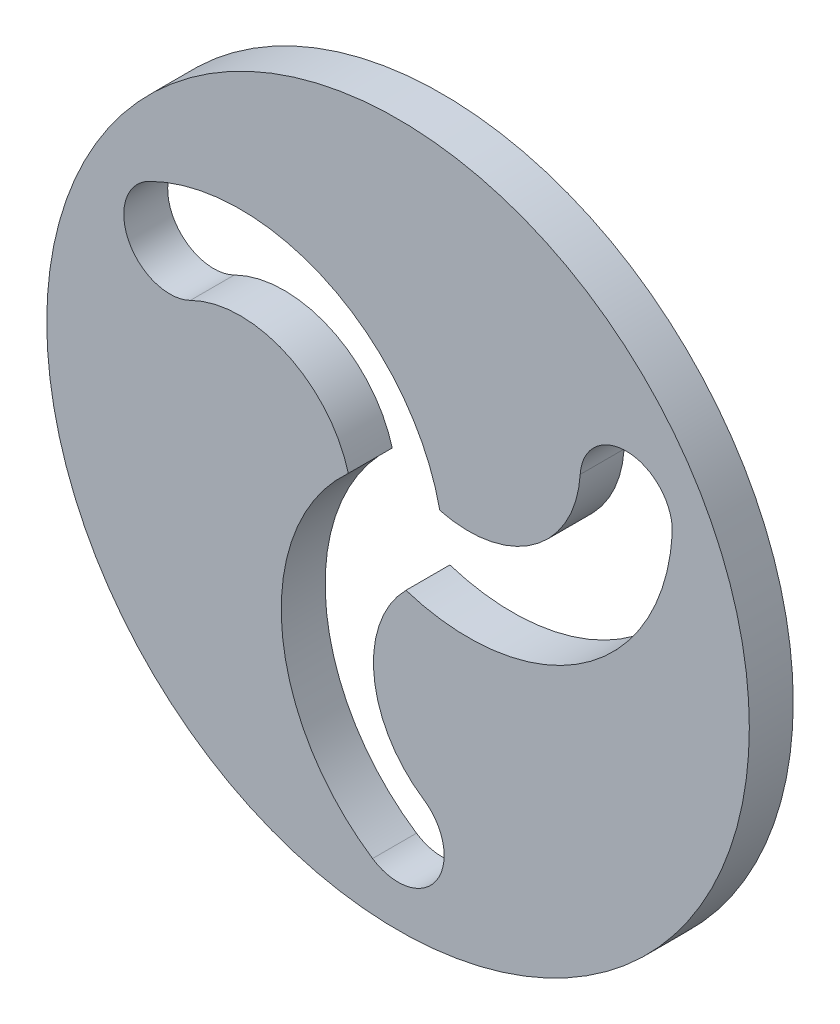
from build123d import *

# Parameters (mm, degrees)
CROQUIS1_R              = 40
DISCO_DEPTH             = 5
CORTAR_EXTRUIR1_DEPTH   = 10
CROQUIS7_R              = 5
SALIENTE_EXTRUIR2_DEPTH = 2


with BuildPart() as part:
    # Croquis1 → Disco (new body)
    with BuildSketch(Plane.XY):
        Circle(CROQUIS1_R)
    extrude(amount=DISCO_DEPTH)

    # Croquis6 → Cortar-Extruir1 (cut)
    with BuildSketch(Plane.XY.offset(5)):
        with BuildLine():
            ThreePointArc((20.740877626, 15.325746158), (15.478626449, 5.779368175), (4.761182136, 3.789140187))
            ThreePointArc((4.761182136, 3.789140187), (-7.887176724, 19.835329272), (-28.318599909, 19.700746158))
            ThreePointArc((-28.318599909, 19.700746158), (-30.681508271, 12.662162204), (-23.642924318, 10.299253842))
            ThreePointArc((-23.642924318, 10.299253842), (-12.744392882, 10.515199633), (-5.662082728, 2.228734589))
            ThreePointArc((-5.662082728, 2.228734589), (-13.23431068, -16.748160043), (-2.902046692, -34.375))
            ThreePointArc((-2.902046692, -34.375), (4.375, -32.902046692), (2.902046692, -25.625))
            ThreePointArc((2.902046692, -25.625), (-2.734233567, -16.294567808), (0.900900592, -6.017874775))
            ThreePointArc((0.900900592, -6.017874775), (21.121487404, -3.087169229), (31.220646601, 14.674253842))
            ThreePointArc((31.220646601, 14.674253842), (26.306508271, 20.239884487), (20.740877626, 15.325746158))
        make_face()
    extrude(amount=-CORTAR_EXTRUIR1_DEPTH, mode=Mode.SUBTRACT)

    # Croquis7 → Saliente-Extruir2 (add)
    with BuildSketch(Plane(origin=(0, 0, 0), x_dir=(-1, 0, 0), z_dir=(0, 0, -1))):
        with Locations(Location((0, 30, 0), (0, 0, 180))):
            Circle(CROQUIS7_R)
        with Locations(Location((25.980762114, -15, 0), (0, 0, 180))):
            Circle(CROQUIS7_R)
        with Locations(Location((-25.980762114, -15, 0), (0, 0, 180))):
            Circle(CROQUIS7_R)
    extrude(amount=SALIENTE_EXTRUIR2_DEPTH)


solid = part.part
